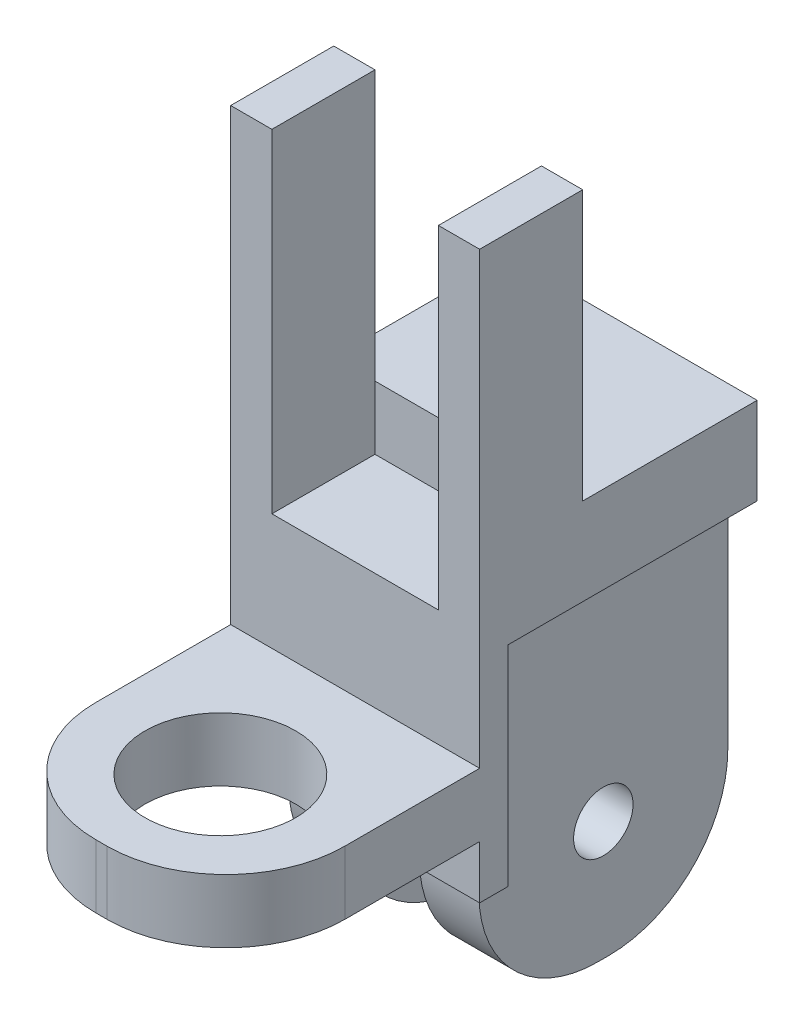
from build123d import *

# Parameters (mm, degrees)
SKETCH4_W            = 31.4
SKETCH4_H            = 31.4
SKETCH4_W_2          = 25.4
SKETCH4_H_2          = 25.4
BOSS_EXTRUDE3_DEPTH  = 30
SKETCH5_W            = 31.4
SKETCH5_H            = 31.4
BOSS_EXTRUDE4_DEPTH  = 5
SKETCH6_W            = 31.4
SKETCH6_H            = 8
BOSS_EXTRUDE5_DEPTH  = 5
BOSS_EXTRUDE6_DEPTH  = 8
SKETCH8_R            = 9.5
BOSS_EXTRUDE7_DEPTH  = 8
SKETCH9_W            = 31.4
SKETCH9_H            = 10
BOSS_EXTRUDE8_DEPTH  = 5
SKETCH10_W           = 31.4
SKETCH10_H           = 10
BOSS_EXTRUDE9_DEPTH  = 11
SKETCH11_W           = 5.2
SKETCH11_H           = 10
BOSS_EXTRUDE10_DEPTH = 40
BOSS_EXTRUDE11_DEPTH = 3
SKETCH13_W           = 31.4
SKETCH13_H           = 31.4
CUT_EXTRUDE1_DEPTH   = 31.4
SKETCH15_W           = 31.4
SKETCH15_H           = 11
BOSS_EXTRUDE12_DEPTH = 12
SKETCH17_W           = 7.5
SKETCH17_H           = 31.4
BOSS_EXTRUDE13_DEPTH = 10
SKETCH18_R           = 3.75
BOSS_EXTRUDE14_DEPTH = 7.5
SKETCH19_W           = 3.6
SKETCH19_H           = 5
CUT_EXTRUDE2_DEPTH   = 31.4
CUT_EXTRUDE3_START   = 8
SKETCH8_2_R          = 9.5
CUT_EXTRUDE3_DEPTH   = 24
SKETCH20_W           = 9
SKETCH20_H           = 1
CUT_EXTRUDE4_DEPTH   = 26.4
SKETCH21_W           = 21
SKETCH21_H           = 13
CUT_EXTRUDE5_DEPTH   = 2


with BuildPart() as part:
    # Sketch4 → Boss-Extrude3 (new body)
    with BuildSketch(Plane.XY):
        Rectangle(SKETCH4_W, SKETCH4_H)
        Rectangle(SKETCH4_W_2, SKETCH4_H_2, mode=Mode.SUBTRACT)
    extrude(amount=BOSS_EXTRUDE3_DEPTH)

    # Sketch5 → Boss-Extrude4 (add)
    with BuildSketch(Plane.XY.offset(30)):
        Rectangle(SKETCH5_W, SKETCH5_H)
    extrude(amount=BOSS_EXTRUDE4_DEPTH)

    # Sketch6 → Boss-Extrude5 (add)
    with BuildSketch(Plane.XY.offset(35)):
        Rectangle(SKETCH6_W, SKETCH6_H)
    extrude(amount=BOSS_EXTRUDE5_DEPTH)

    # Sketch7 → Boss-Extrude6 (add)
    with BuildSketch(Plane.XZ.offset(4)):
        with BuildLine():
            Line((-15.7, 40), (-15.7, 52))
            ThreePointArc((-15.7, 52), (-11.306601718, 62.606601718), (-0.7, 67))
            Line((-0.7, 67), (0.7, 67))
            ThreePointArc((0.7, 67), (11.306601718, 62.606601718), (15.7, 52))
            Line((15.7, 52), (15.7, 40))
            Line((15.7, 40), (-15.7, 40))
        make_face()
    extrude(amount=-BOSS_EXTRUDE6_DEPTH)

    # Sketch8 → Boss-Extrude7 (add)
    with BuildSketch(Plane.XZ.offset(4)):
        with Locations((0, 52)):
            Circle(SKETCH8_R)
    boss_extrude7 = extrude(amount=BOSS_EXTRUDE7_DEPTH)

    # Mirror1: Boss-Extrude7 across plane
    add(boss_extrude7.mirror(Plane.ZX))

    # Sketch9 → Boss-Extrude8 (add)
    with BuildSketch(Plane(origin=(0, 15.7, 0), x_dir=(1, 0, 0), z_dir=(0, 1, 0))):
        with Locations((0, -27)):
            Rectangle(SKETCH9_W, SKETCH9_H)
    extrude(amount=BOSS_EXTRUDE8_DEPTH)

    # Sketch10 → Boss-Extrude9 (add)
    with BuildSketch(Plane(origin=(0, 15.7, 0), x_dir=(1, 0, 0), z_dir=(0, 1, 0))):
        with Locations((0, -17)):
            Rectangle(SKETCH10_W, SKETCH10_H)
    extrude(amount=BOSS_EXTRUDE9_DEPTH)

    # Sketch11 → Boss-Extrude10 (add)
    with BuildSketch(Plane(origin=(0, 20.7, 0), x_dir=(1, 0, 0), z_dir=(0, 1, 0))):
        with Locations((-13.1, -27)):
            Rectangle(SKETCH11_W, SKETCH11_H)
        with Locations((13.1, -27)):
            Rectangle(SKETCH11_W, SKETCH11_H)
    extrude(amount=BOSS_EXTRUDE10_DEPTH)

    # Sketch12 → Boss-Extrude11 (add)
    with BuildSketch(Plane.XY.offset(32)):
        Polygon((-15.7, 60.7), (-10.5, 60.7), (-10.5, 20.7), (10.5, 20.7), (10.5, 60.7), (15.7, 60.7), (15.7, 15.7), (-15.7, 15.7), align=None)
    extrude(amount=BOSS_EXTRUDE11_DEPTH)

    # Sketch13 → Cut-Extrude1 (cut)
    with BuildSketch(Plane.ZY.offset(15.7)):
        with Locations((15.7, 0)):
            Rectangle(SKETCH13_W, SKETCH13_H)
    extrude(amount=-CUT_EXTRUDE1_DEPTH, mode=Mode.SUBTRACT)

    # Sketch15 → Boss-Extrude12 (add)
    with BuildSketch(Plane(origin=(0, 0, 12), x_dir=(-1, 0, 0), z_dir=(0, 0, -1))):
        with Locations((0, 21.2)):
            Rectangle(SKETCH15_W, SKETCH15_H)
    extrude(amount=BOSS_EXTRUDE12_DEPTH)

    # Sketch17 → Boss-Extrude13 (add)
    with BuildSketch(Plane.XZ.offset(-15.7)):
        with Locations((-8.25, 15.7)):
            Rectangle(SKETCH17_W, SKETCH17_H)
    boss_extrude13 = extrude(amount=BOSS_EXTRUDE13_DEPTH)

    # Sketch18 → Boss-Extrude14 (add)
    with BuildSketch(Plane.ZY.offset(12)):
        with BuildLine():
            Line((31.4, 5.7), (0, 5.7))
            Line((0, 5.7), (0, -13.3))
            ThreePointArc((0, -13.3), (4.393398282, -23.906601718), (15, -28.3))
            Line((15, -28.3), (16.4, -28.3))
            ThreePointArc((16.4, -28.3), (27.006601718, -23.906601718), (31.4, -13.3))
            Line((31.4, -13.3), (31.4, 5.7))
        make_face()
        with Locations((15.7, -13.3)):
            Circle(SKETCH18_R, mode=Mode.SUBTRACT)
    boss_extrude14 = extrude(amount=-BOSS_EXTRUDE14_DEPTH)

    # Mirror3: Boss-Extrude13, Boss-Extrude14 across plane
    add(boss_extrude13.mirror(Plane(origin=(0, 0, 0), x_dir=(0, 0, 1), z_dir=(1, 0, 0))))
    add(boss_extrude14.mirror(Plane(origin=(0, 0, 0), x_dir=(0, 0, 1), z_dir=(1, 0, 0))))

    # Sketch19 → Cut-Extrude2 (cut)
    with BuildSketch(Plane(origin=(15.7, 0, 0), x_dir=(0, 0, -1), z_dir=(1, 0, 0))):
        with Locations((-33.2, -13.2)):
            Rectangle(SKETCH19_W, SKETCH19_H)
    extrude(amount=-CUT_EXTRUDE2_DEPTH, mode=Mode.SUBTRACT)

    # Sketch8<2> → Cut-Extrude3 (cut)
    with BuildSketch(Plane.XZ.offset(4).offset(CUT_EXTRUDE3_START)):
        with Locations((0, 52)):
            Circle(SKETCH8_2_R)
    extrude(amount=-CUT_EXTRUDE3_DEPTH, mode=Mode.SUBTRACT)

    # Sketch20 → Cut-Extrude4 (cut)
    with BuildSketch(Plane.XZ.offset(10.7)):
        with Locations((0, 31.9)):
            Rectangle(SKETCH20_W, SKETCH20_H)
    extrude(amount=-CUT_EXTRUDE4_DEPTH, mode=Mode.SUBTRACT)

    # Sketch21 → Cut-Extrude5 (cut)
    with BuildSketch(Plane(origin=(0, 20.7, 0), x_dir=(1, 0, 0), z_dir=(0, 1, 0))):
        with Locations((0, -28.5)):
            Rectangle(SKETCH21_W, SKETCH21_H)
    extrude(amount=-CUT_EXTRUDE5_DEPTH, mode=Mode.SUBTRACT)


solid = part.part
